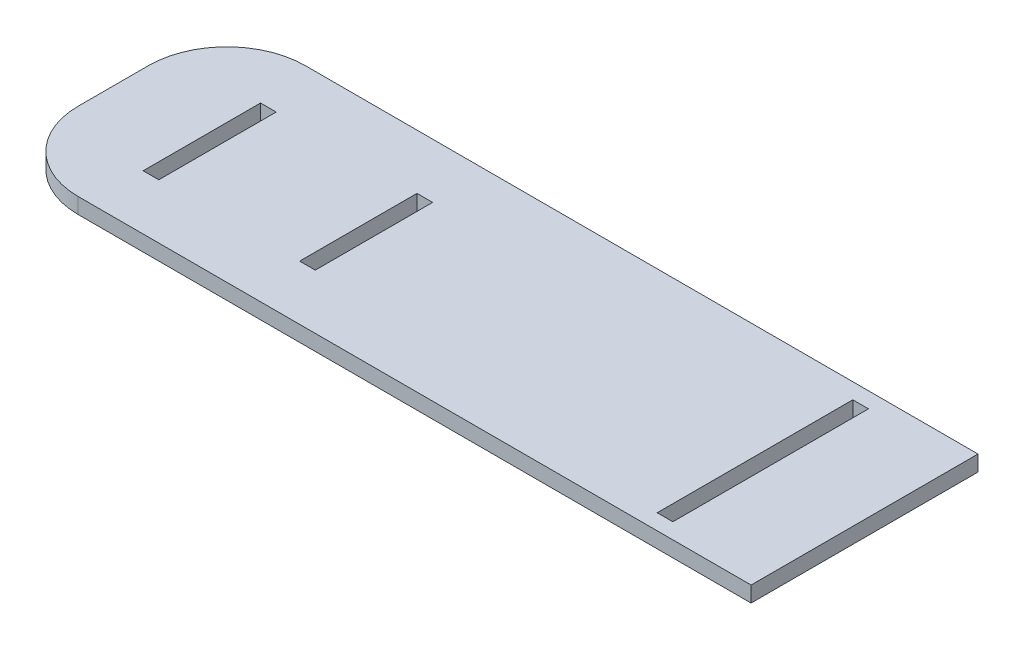
from build123d import *

# Parameters (mm, degrees)
SKETCH1_W           = 960
SKETCH1_H           = 290
BOSS_EXTRUDE1_DEPTH = 20
FILLET1_R           = 100
SKETCH5_W           = 20
SKETCH5_H           = 250
SKETCH5_H_2         = 150
CUT_EXTRUDE1_DEPTH  = 20


with BuildPart() as part:
    # Sketch1 → Boss-Extrude1 (new body)
    with BuildSketch(Plane(origin=(0, 0, 0), x_dir=(1, 0, 0), z_dir=(0, 1, 0))):
        with Locations((-480, 0)):
            Rectangle(SKETCH1_W, SKETCH1_H)
    extrude(amount=BOSS_EXTRUDE1_DEPTH)

    # Fillet1
    fillet1_edges = [part.edges().sort_by_distance(p)[0] for p in [
        (-960, 10, 145),
        (-960, 10, -145),
    ]]
    fillet(fillet1_edges, radius=FILLET1_R)

    # Sketch5 → Cut-Extrude1 (cut)
    with BuildSketch(Plane.XZ):
        with Locations((-130, 0)):
            Rectangle(SKETCH5_W, SKETCH5_H)
        with Locations((-637, 0)):
            Rectangle(SKETCH5_W, SKETCH5_H_2)
        with Locations((-837, 0)):
            Rectangle(SKETCH5_W, SKETCH5_H_2)
    extrude(amount=-CUT_EXTRUDE1_DEPTH, mode=Mode.SUBTRACT)


solid = part.part
